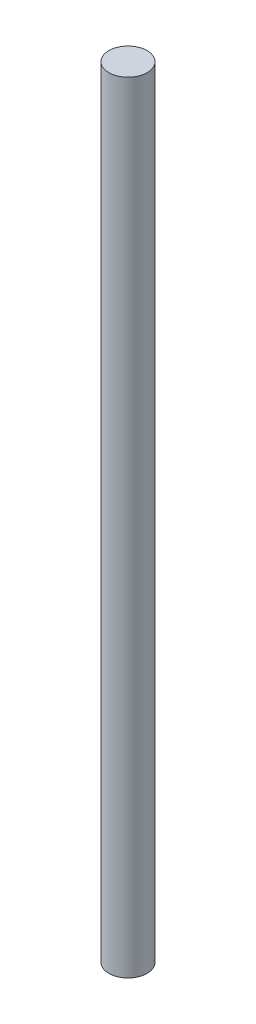
from build123d import *

# Parameters (mm, degrees)
SKETCH_1_R      = 1.5
EXTRUDE_1_DEPTH = 61.2


with BuildPart() as part:
    # 草图1 → 凸台-拉伸1 (new body)
    with BuildSketch(Plane(origin=(0, 0, 0), x_dir=(1, 0, 0), z_dir=(0, 1, 0))):
        with Locations(Location((0, 0, 0), (0, 0, 270))):
            Circle(SKETCH_1_R)
    extrude(amount=EXTRUDE_1_DEPTH)


solid = part.part
